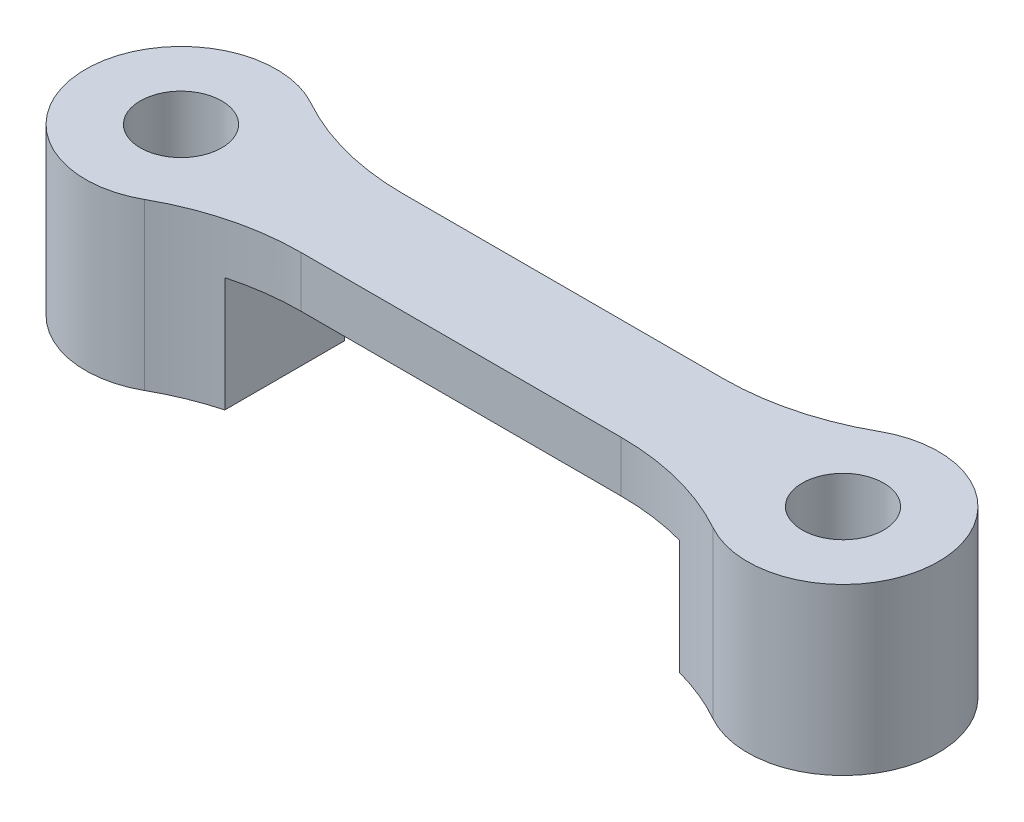
from build123d import *

# Parameters (mm, degrees)
SKETCH1_R           = 1.6
BOSS_EXTRUDE1_DEPTH = 6.5
FILLET1_R           = 10
SKETCH2_W           = 17.85
SKETCH2_H           = 4.708375864
CUT_EXTRUDE1_DEPTH  = 4.5


with BuildPart() as part:
    # Sketch1 → Boss-Extrude1 (new body)
    with BuildSketch(Plane(origin=(0, 0, 0), x_dir=(1, 0, 0), z_dir=(0, 1, 0))):
        with BuildLine():
            Line((9.827855615, 2), (-9.827855615, 2))
            ThreePointArc((-9.827855615, 2), (-16.75, 0), (-9.827855615, -2))
            Line((-9.827855615, -2), (9.827855615, -2))
            ThreePointArc((9.827855615, -2), (16.75, 0), (9.827855615, 2))
        make_face()
        with Locations(Location((-13, 0, 0), (0, 0, 90))):
            Circle(SKETCH1_R, mode=Mode.SUBTRACT)
        with Locations(Location((13, 0, 0), (0, 0, 90))):
            Circle(SKETCH1_R, mode=Mode.SUBTRACT)
    extrude(amount=BOSS_EXTRUDE1_DEPTH)

    # Fillet1
    fillet1_edges = [part.edges().sort_by_distance(p)[0] for p in [
        (-9.827855615, 3.25, -2),
        (9.827855615, 3.25, -2),
        (9.827855615, 3.25, 2),
        (-9.827855615, 3.25, 2),
    ]]
    fillet(fillet1_edges, radius=FILLET1_R)

    # Sketch2 → Cut-Extrude1 (cut)
    with BuildSketch(Plane(origin=(0, 0, 0), x_dir=(-1, 0, 0), z_dir=(0, -1, 0))):
        Rectangle(SKETCH2_W, SKETCH2_H)
    extrude(amount=-CUT_EXTRUDE1_DEPTH, mode=Mode.SUBTRACT)


solid = part.part
